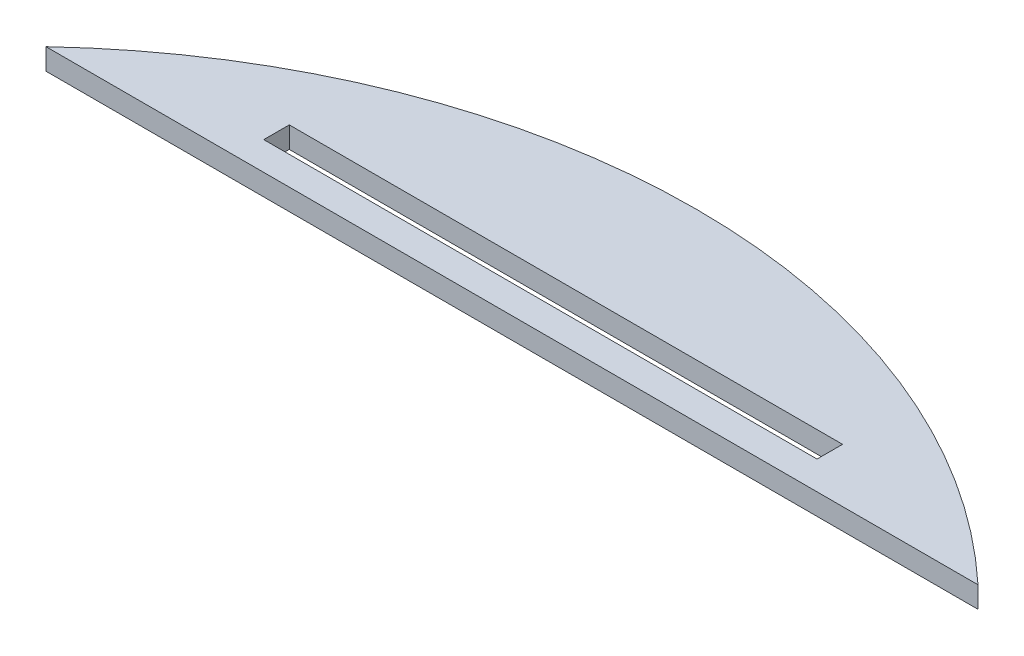
from build123d import *

# Parameters (mm, degrees)
SKETCH1_R           = 48
BOSS_EXTRUDE1_DEPTH = 1.5
CUT_EXTRUDE1_START  = -1.5
CUT_EXTRUDE1_DEPTH  = 1.5
SKETCH3_W           = 39
SKETCH3_H           = 1.8
CUT_EXTRUDE2_DEPTH  = 1.5


with BuildPart() as part:
    # Sketch1 → Boss-Extrude1 (new body)
    with BuildSketch(Plane(origin=(0, 0, 0), x_dir=(1, 0, 0), z_dir=(0, 1, 0))):
        with Locations(Location((0, 0, 0), (0, 0, 270))):
            Circle(SKETCH1_R)
    extrude(amount=BOSS_EXTRUDE1_DEPTH)

    # Sketch2 → Cut-Extrude1 (cut)
    with BuildSketch(Plane(origin=(0, 1.5, 0), x_dir=(1, 0, 0), z_dir=(0, 1, 0)).offset(CUT_EXTRUDE1_START)):
        with BuildLine():
            Line((-32.848135411, 35), (32.848135411, 35))
            ThreePointArc((32.848135411, 35), (0, -48), (-32.848135411, 35))
        make_face()
    extrude(amount=CUT_EXTRUDE1_DEPTH, mode=Mode.SUBTRACT)

    # Sketch3 → Cut-Extrude2 (cut)
    with BuildSketch(Plane(origin=(0, 1.5, 0), x_dir=(1, 0, 0), z_dir=(0, 1, 0))):
        with Locations((0, 37.9)):
            Rectangle(SKETCH3_W, SKETCH3_H)
    extrude(amount=-CUT_EXTRUDE2_DEPTH, mode=Mode.SUBTRACT)


solid = part.part
